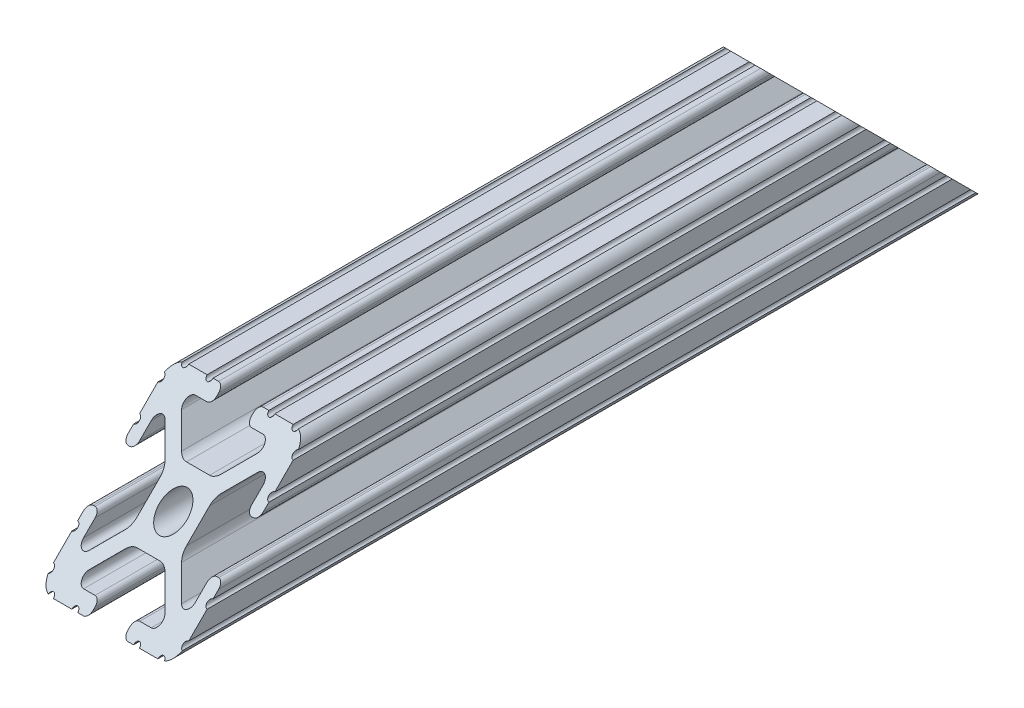
from build123d import *

# Parameters (mm, degrees)
SKETCH2_R           = 2.6035
BOSS_EXTRUDE1_DEPTH = 152.4
CUT_EXTRUDE2_DEPTH  = 203.2


with BuildPart() as part:
    # Sketch2 → Boss-Extrude1 (new body)
    with BuildSketch(Plane.XY):
        with BuildLine():
            Line((-3.737334562, -5.299899128), (-7.103895736, -8.666460301))
            ThreePointArc((-7.103895736, -8.666460301), (-7.335478831, -9.830707141), (-6.348478019, -10.4902))
            Line((-6.348478019, -10.4902), (-4.190365, -10.4902))
            ThreePointArc((-4.190365, -10.4902), (-3.52627506, -10.76527506), (-3.2512, -11.429365))
            Line((-3.2512, -11.429365), (-3.2512, -11.760835))
            ThreePointArc((-3.2512, -11.760835), (-3.52627506, -12.42492494), (-4.190365, -12.7))
            Line((-4.190365, -12.7), (-5.243578019, -12.7))
            ThreePointArc((-5.243578019, -12.7), (-5.796028019, -12.14755), (-6.348478019, -12.7))
            Line((-6.348478019, -12.7), (-9.803703153, -12.7))
            ThreePointArc((-9.803703153, -12.7), (-10.295790179, -12.150857656), (-10.895412136, -12.579996867))
            ThreePointArc((-10.895412136, -12.579996867), (-11.943543586, -11.943543585), (-12.579996867, -10.895412135))
            ThreePointArc((-12.579996867, -10.895412135), (-12.150857661, -10.295790179), (-12.7, -9.803703154))
            Line((-12.7, -9.803703154), (-12.7, -6.348478019))
            ThreePointArc((-12.7, -6.348478019), (-12.14755, -5.796028019), (-12.7, -5.243578019))
            Line((-12.7, -5.243578019), (-12.7, -4.190365))
            ThreePointArc((-12.7, -4.190365), (-12.42492494, -3.52627506), (-11.760835, -3.2512))
            Line((-11.760835, -3.2512), (-11.429365, -3.2512))
            ThreePointArc((-11.429365, -3.2512), (-10.76527506, -3.52627506), (-10.4902, -4.190365))
            Line((-10.4902, -4.190365), (-10.4902, -6.348478019))
            ThreePointArc((-10.4902, -6.348478019), (-9.830707141, -7.335478831), (-8.666460302, -7.103895737))
            Line((-8.666460302, -7.103895737), (-5.299899128, -3.737334563))
            ThreePointArc((-5.299899128, -3.737334563), (-4.817571085, -3.015479635), (-4.6482, -2.163993691))
            Line((-4.6482, -2.163993691), (-4.6482, 2.16399369))
            ThreePointArc((-4.6482, 2.16399369), (-4.817571084, 3.015479634), (-5.299899127, 3.737334562))
            Line((-5.299899127, 3.737334562), (-8.666460301, 7.103895736))
            ThreePointArc((-8.666460301, 7.103895736), (-9.83070714, 7.335478831), (-10.490199999, 6.348478019))
            Line((-10.490199999, 6.348478019), (-10.490199999, 4.190365))
            ThreePointArc((-10.490199999, 4.190365), (-10.765275058, 3.52627506), (-11.429364999, 3.2512))
            Line((-11.429364999, 3.2512), (-11.760834999, 3.2512))
            ThreePointArc((-11.760834999, 3.2512), (-12.424924939, 3.52627506), (-12.699999999, 4.190365))
            Line((-12.699999999, 4.190365), (-12.699999999, 5.243578019))
            ThreePointArc((-12.699999999, 5.243578019), (-12.147549999, 5.796028019), (-12.699999999, 6.348478019))
            Line((-12.699999999, 6.348478019), (-12.699999999, 9.803703154))
            ThreePointArc((-12.699999999, 9.803703154), (-12.15085766, 10.295790179), (-12.579996866, 10.895412135))
            ThreePointArc((-12.579996866, 10.895412135), (-11.943543584, 11.943543586), (-10.895412134, 12.579996867))
            ThreePointArc((-10.895412134, 12.579996867), (-10.295790177, 12.150857661), (-9.803703152, 12.7))
            Line((-9.803703152, 12.7), (-6.348478018, 12.7))
            ThreePointArc((-6.348478018, 12.7), (-5.796028018, 12.14755), (-5.243578018, 12.7))
            Line((-5.243578018, 12.7), (-4.190364999, 12.7))
            ThreePointArc((-4.190364999, 12.7), (-3.526275058, 12.42492494), (-3.251199999, 11.760835))
            Line((-3.251199999, 11.760835), (-3.251199999, 11.429365))
            ThreePointArc((-3.251199999, 11.429365), (-3.526275058, 10.76527506), (-4.190364999, 10.4902))
            Line((-4.190364999, 10.4902), (-6.348478018, 10.4902))
            ThreePointArc((-6.348478018, 10.4902), (-7.33547883, 9.830707142), (-7.103895735, 8.666460303))
            Line((-7.103895735, 8.666460303), (-3.737334561, 5.299899129))
            ThreePointArc((-3.737334561, 5.299899129), (-3.015479634, 4.817571086), (-2.16399369, 4.6482))
            Line((-2.16399369, 4.6482), (2.163993692, 4.6482))
            ThreePointArc((2.163993692, 4.6482), (3.015479636, 4.817571085), (3.737334564, 5.299899128))
            Line((3.737334564, 5.299899128), (7.103895738, 8.666460302))
            ThreePointArc((7.103895738, 8.666460302), (7.335478833, 9.830707141), (6.348478021, 10.4902))
            Line((6.348478021, 10.4902), (4.190365002, 10.4902))
            ThreePointArc((4.190365002, 10.4902), (3.526275062, 10.76527506), (3.251200002, 11.429365))
            Line((3.251200002, 11.429365), (3.251200002, 11.760835))
            ThreePointArc((3.251200002, 11.760835), (3.526275062, 12.42492494), (4.190365002, 12.7))
            Line((4.190365002, 12.7), (5.243578021, 12.7))
            ThreePointArc((5.243578021, 12.7), (5.796028021, 12.14755), (6.348478021, 12.7))
            Line((6.348478021, 12.7), (9.803703155, 12.7))
            ThreePointArc((9.803703155, 12.7), (10.295790181, 12.150857656), (10.895412138, 12.579996867))
            ThreePointArc((10.895412138, 12.579996867), (11.943543588, 11.943543585), (12.579996869, 10.895412136))
            ThreePointArc((12.579996869, 10.895412136), (12.150857663, 10.295790179), (12.700000001, 9.803703154))
            Line((12.700000001, 9.803703154), (12.700000001, 6.34847802))
            ThreePointArc((12.700000001, 6.34847802), (12.147550001, 5.79602802), (12.700000001, 5.24357802))
            Line((12.700000001, 5.24357802), (12.700000001, 4.190365001))
            ThreePointArc((12.700000001, 4.190365001), (12.424924941, 3.526275061), (11.760835001, 3.251200001))
            Line((11.760835001, 3.251200001), (11.429365001, 3.251200001))
            ThreePointArc((11.429365001, 3.251200001), (10.765275061, 3.526275061), (10.490200001, 4.190365001))
            Line((10.490200001, 4.190365001), (10.490200001, 6.34847802))
            ThreePointArc((10.490200001, 6.34847802), (9.830707143, 7.335478832), (8.666460303, 7.103895738))
            Line((8.666460303, 7.103895738), (5.299899129, 3.737334564))
            ThreePointArc((5.299899129, 3.737334564), (4.817571086, 3.015479636), (4.648200001, 2.163993692))
            Line((4.648200001, 2.163993692), (4.648200001, -2.163993689))
            ThreePointArc((4.648200001, -2.163993689), (4.817571086, -3.015479633), (5.299899128, -3.737334561))
            Line((5.299899128, -3.737334561), (8.666460302, -7.103895735))
            ThreePointArc((8.666460302, -7.103895735), (9.830707141, -7.33547883), (10.4902, -6.348478018))
            Line((10.4902, -6.348478018), (10.4902, -4.190364999))
            ThreePointArc((10.4902, -4.190364999), (10.76527506, -3.526275059), (11.429365, -3.251199999))
            Line((11.429365, -3.251199999), (11.760835, -3.251199999))
            ThreePointArc((11.760835, -3.251199999), (12.42492494, -3.526275059), (12.7, -4.190364999))
            Line((12.7, -4.190364999), (12.7, -5.243578018))
            ThreePointArc((12.7, -5.243578018), (12.14755, -5.796028018), (12.7, -6.348478018))
            Line((12.7, -6.348478018), (12.7, -9.803703153))
            ThreePointArc((12.7, -9.803703153), (12.150857661, -10.295790178), (12.579996867, -10.895412134))
            ThreePointArc((12.579996867, -10.895412134), (11.943543586, -11.943543584), (10.895412136, -12.579996866))
            ThreePointArc((10.895412136, -12.579996866), (10.295790179, -12.150857655), (9.803703154, -12.699999999))
            Line((9.803703154, -12.699999999), (6.348478019, -12.699999999))
            ThreePointArc((6.348478019, -12.699999999), (5.796028019, -12.147549999), (5.243578019, -12.699999999))
            Line((5.243578019, -12.699999999), (4.190365, -12.699999999))
            ThreePointArc((4.190365, -12.699999999), (3.52627506, -12.424924939), (3.2512, -11.760834999))
            Line((3.2512, -11.760834999), (3.2512, -11.429364999))
            ThreePointArc((3.2512, -11.429364999), (3.52627506, -10.765275059), (4.190365, -10.490199999))
            Line((4.190365, -10.490199999), (6.348478019, -10.490199999))
            ThreePointArc((6.348478019, -10.490199999), (7.335478831, -9.830707141), (7.103895737, -8.666460301))
            Line((7.103895737, -8.666460301), (3.737334563, -5.299899128))
            ThreePointArc((3.737334563, -5.299899128), (3.015479635, -4.817571085), (2.163993691, -4.648199999))
            Line((2.163993691, -4.648199999), (-2.163993691, -4.648199999))
            ThreePointArc((-2.163993691, -4.648199999), (-3.015479635, -4.817571085), (-3.737334562, -5.299899128))
        make_face()
        with Locations(Location((0, 0, 0), (0, 0, 180))):
            Circle(SKETCH2_R, mode=Mode.SUBTRACT)
    extrude(amount=BOSS_EXTRUDE1_DEPTH)

    # Sketch3 → Cut-Extrude2 (cut)
    with BuildSketch(Plane.ZY.offset(12.7)):
        Polygon((0, 12.579996867), (0, -12.579996867), (43.293899486, 30.713902619), (0, 30.713902619), align=None)
        Polygon((152.4, -12.7), (90.501543174, 49.198456826), (152.4, 49.198456826), align=None)
    extrude(amount=-CUT_EXTRUDE2_DEPTH, mode=Mode.SUBTRACT)


solid = part.part
